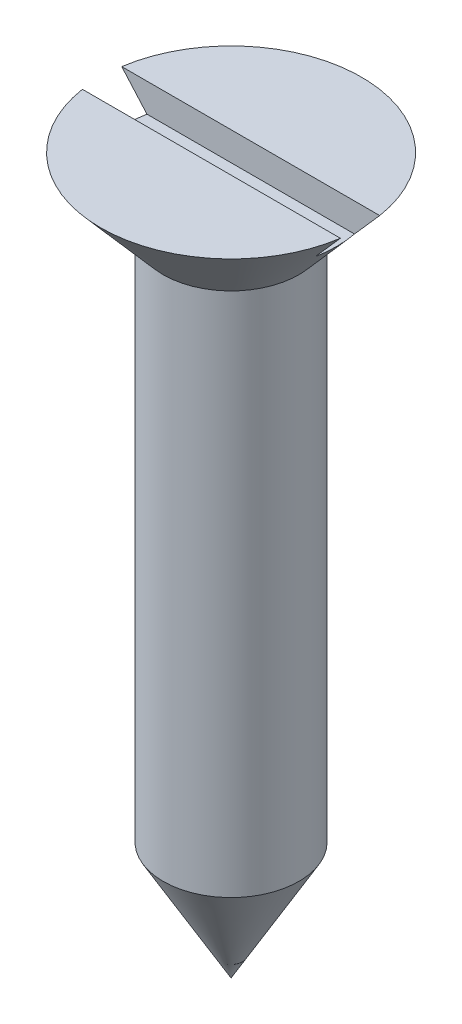
from build123d import *

# Parameters (mm, degrees)
SKETCH1_R           = 2.413
BOSS_EXTRUDE1_DEPTH = 25.4
SKETCH4_W           = 11.811
SKETCH4_H           = 1.397
CUT_EXTRUDE1_DEPTH  = 1.016


with BuildPart() as part:
    # Sketch1 → Boss-Extrude1 (new body)
    with BuildSketch(Plane(origin=(0, 0, 0), x_dir=(1, 0, 0), z_dir=(0, 1, 0))):
        with Locations(Location((0, 0, 0), (0, 0, 270))):
            Circle(SKETCH1_R)
    extrude(amount=BOSS_EXTRUDE1_DEPTH)

    # Sketch2 → Revolve1 (revolve)
    with BuildSketch(Plane.XY, mode=Mode.PRIVATE) as revolve1_sk:
        Polygon((0, 25.4), (4.6355, 25.4), (0, 20.067467248), align=None)
    revolve(revolve1_sk.sketch.rotate(Axis((0, 29.481052866, 0), (0, -1, 0)), 90), axis=Axis((0, 29.481052866, 0), (0, -1, 0)))

    # Sketch3 → Cut-Revolve2 (revolve, cut)
    with BuildSketch(Plane.XY, mode=Mode.PRIVATE) as cut_revolve2_sk:
        Polygon((0, 0), (2.413, 4.179438599), (2.413, -0.635), (0, -0.635), align=None)
    revolve(cut_revolve2_sk.sketch.rotate(Axis((0, 26.334399409, 0), (0, -1, 0)), 90), axis=Axis((0, 26.334399409, 0), (0, -1, 0)), mode=Mode.SUBTRACT)

    # Sketch4 → Cut-Extrude1 (cut)
    with BuildSketch(Plane(origin=(0, 25.4, 0), x_dir=(1, 0, 0), z_dir=(0, 1, 0))):
        Rectangle(SKETCH4_W, SKETCH4_H)
    extrude(amount=-CUT_EXTRUDE1_DEPTH, mode=Mode.SUBTRACT)


solid = part.part
